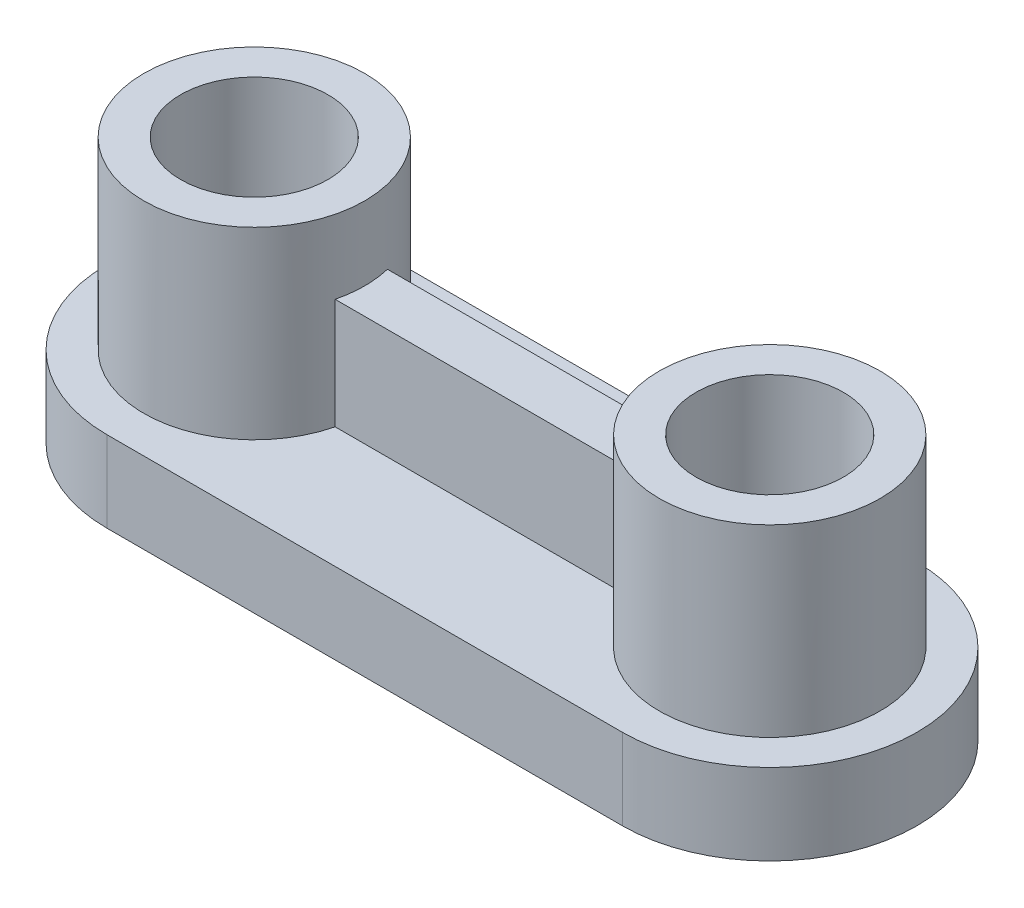
from build123d import *

# Parameters (mm, degrees)
BOSS_EXTRUDE2_DEPTH = 11
SKETCH5_R           = 15
BOSS_EXTRUDE4_DEPTH = 25
SKETCH6_R           = 10
CUT_EXTRUDE1_DEPTH  = 20
SKETCH7_R           = 7.5
CUT_EXTRUDE2_DEPTH  = 289.149419546
SKETCH8_W           = 40.868784051
SKETCH8_H           = 7.083722135
BOSS_EXTRUDE5_DEPTH = 15
SKETCH9_W           = 36
SKETCH9_H           = 18
CUT_EXTRUDE3_DEPTH  = 5


with BuildPart() as part:
    # Sketch3 → Boss-Extrude2 (new body)
    with BuildSketch(Plane(origin=(0, 0, 0), x_dir=(1, 0, 0), z_dir=(0, 1, 0))):
        with BuildLine():
            Line((-266.757890885, 20), (-196.757890885, 20))
            ThreePointArc((-196.757890885, 20), (-176.757890885, 0), (-196.757890885, -20))
            Line((-196.757890885, -20), (-266.757890885, -20))
            ThreePointArc((-266.757890885, -20), (-286.757890885, 0), (-266.757890885, 20))
        make_face()
    extrude(amount=BOSS_EXTRUDE2_DEPTH)

    # Sketch5 → Boss-Extrude4 (add)
    with BuildSketch(Plane(origin=(0, 11, 0), x_dir=(1, 0, 0), z_dir=(0, 1, 0))):
        with Locations(Location((-196.757890885, 0, 0), (0, 0, 90))):
            Circle(SKETCH5_R)
        with Locations(Location((-266.757890885, 0, 0), (0, 0, 90))):
            Circle(SKETCH5_R)
    extrude(amount=BOSS_EXTRUDE4_DEPTH)

    # Sketch6 → Cut-Extrude1 (cut)
    with BuildSketch(Plane(origin=(0, 36, 0), x_dir=(1, 0, 0), z_dir=(0, 1, 0))):
        with Locations(Location((-266.757890885, 0, 0), (0, 0, 270))):
            Circle(SKETCH6_R)
        with Locations(Location((-196.757890885, 0, 0), (0, 0, 270))):
            Circle(SKETCH6_R)
    extrude(amount=-CUT_EXTRUDE1_DEPTH, mode=Mode.SUBTRACT)

    # Sketch7 → Cut-Extrude2 (cut, through all)
    with BuildSketch(Plane(origin=(0, 16, 0), x_dir=(1, 0, 0), z_dir=(0, 1, 0))):
        with Locations(Location((-196.757890885, 0, 0), (0, 0, 270))):
            Circle(SKETCH7_R)
        with Locations(Location((-266.757890885, 0, 0), (0, 0, 270))):
            Circle(SKETCH7_R)
    extrude(amount=-CUT_EXTRUDE2_DEPTH, mode=Mode.SUBTRACT)

    # Sketch8 → Boss-Extrude5 (add)
    with BuildSketch(Plane(origin=(0, 11, 0), x_dir=(1, 0, 0), z_dir=(0, 1, 0))):
        with Locations((-231.757890885, -0.041861068)):
            Rectangle(SKETCH8_W, SKETCH8_H)
    extrude(amount=BOSS_EXTRUDE5_DEPTH)

    # Sketch9 → Cut-Extrude3 (cut)
    with BuildSketch(Plane.XZ):
        with Locations((-231.107838077, 0.023445498)):
            Rectangle(SKETCH9_W, SKETCH9_H)
    extrude(amount=-CUT_EXTRUDE3_DEPTH, mode=Mode.SUBTRACT)


solid = part.part
